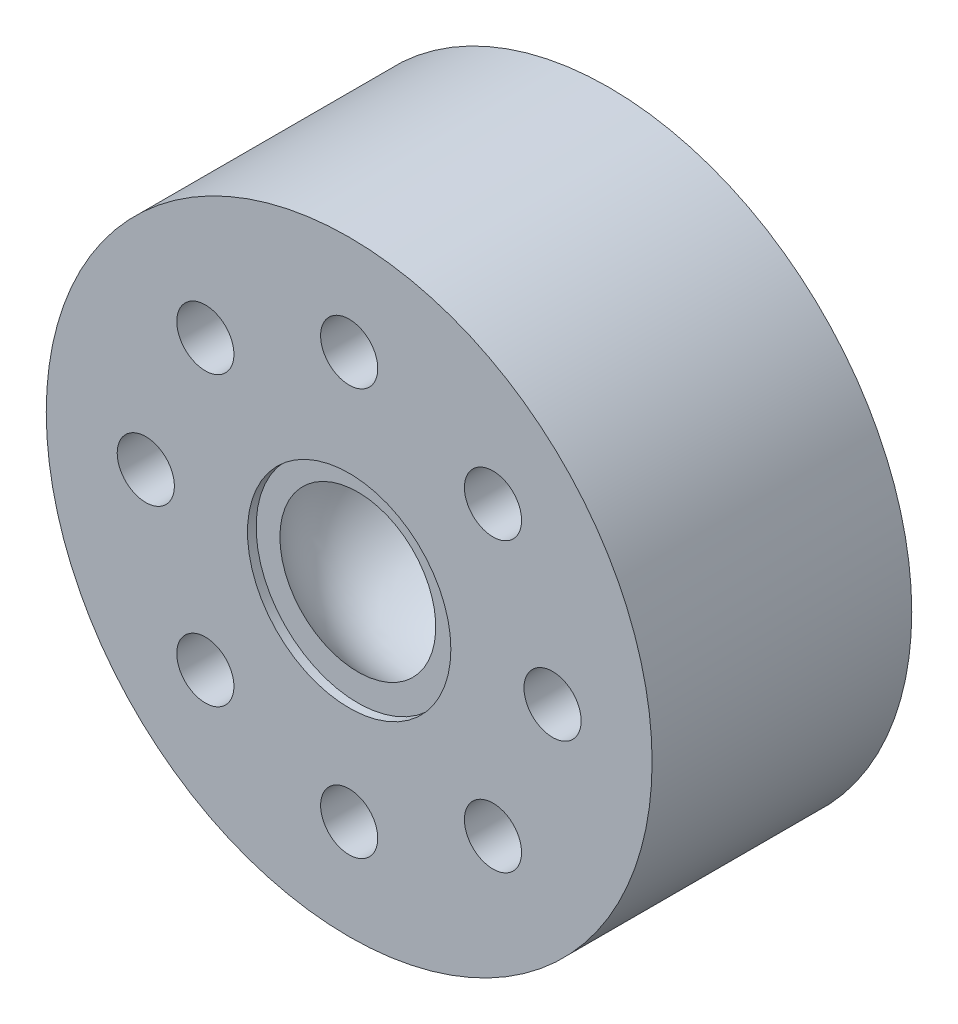
from build123d import *

# Parameters (mm, degrees)
SKETCH1_R           = 35
BOSS_EXTRUDE1_DEPTH = 50
SKETCH2_R           = 11.75
CUT_EXTRUDE1_DEPTH  = 21
SKETCH3_R           = 9
CUT_EXTRUDE2_DEPTH  = 5
SKETCH6_R           = 6.35
CUT_EXTRUDE3_DEPTH  = 71.356236397
CUT_EXTRUDE4_START  = -20
SKETCH7_R           = 35
CUT_EXTRUDE4_DEPTH  = 20
SKETCH9_R           = 3.302
CUT_EXTRUDE6_DEPTH  = 58.879184514


with BuildPart() as part:
    # Sketch1 → Boss-Extrude1 (new body)
    with BuildSketch(Plane.XY):
        Circle(SKETCH1_R)
    extrude(amount=BOSS_EXTRUDE1_DEPTH)

    # Sketch2 → Cut-Extrude1 (cut)
    with BuildSketch(Plane.XY.offset(50)):
        with Locations((0, -0.363798412)):
            Circle(SKETCH2_R)
    extrude(amount=-CUT_EXTRUDE1_DEPTH, mode=Mode.SUBTRACT)

    # Sketch3 → Cut-Extrude2 (cut)
    with BuildSketch(Plane.XY.offset(29)):
        Circle(SKETCH3_R)
    extrude(amount=-CUT_EXTRUDE2_DEPTH, mode=Mode.SUBTRACT)

    # Sketch4 → Cut-Revolve1 (revolve, cut)
    with BuildSketch(Plane(origin=(0, 0, 0), x_dir=(0, 0, -1), z_dir=(1, 0, 0))):
        with BuildLine():
            Line((-8.85349547, 5), (-8.85349547, 0))
            Line((-8.85349547, 0), (-29.014540537, 0))
            Line((-29.014540537, 0), (-29.014540537, 8.986487334))
            add(Edge.make_bspline(
                [(-29.014540537, 8.986487334), (-22.084577695, 17.461249934), (-14.611301832, 9.423177176), (-8.85349547, 5)],
                knots=[0, 0, 0, 0, 1, 1, 1, 1], degree=3))
        make_face()
    revolve(axis=Axis((0, 0, 8.85349547), (0, 0, 1)), mode=Mode.SUBTRACT)

    # Sketch6 → Cut-Extrude3 (cut, through all)
    with BuildSketch(Plane(origin=(0, 0, 0), x_dir=(-1, 0, 0), z_dir=(0, 0, -1))):
        Circle(SKETCH6_R)
    extrude(amount=-CUT_EXTRUDE3_DEPTH, mode=Mode.SUBTRACT)

    # Sketch7 → Cut-Extrude4 (cut)
    with BuildSketch(Plane.XY.offset(50).offset(CUT_EXTRUDE4_START)):
        Circle(SKETCH7_R)
    extrude(amount=CUT_EXTRUDE4_DEPTH, mode=Mode.SUBTRACT)

    # Sketch9 → Cut-Extrude6 (cut, through all)
    with BuildSketch(Plane(origin=(0, 0, 0), x_dir=(-1, 0, 0), z_dir=(0, 0, -1))):
        with Locations((0, -23.5)):
            Circle(SKETCH9_R)
        with Locations((-16.617009358, -16.617009358)):
            Circle(SKETCH9_R)
        with Locations((-23.5, 0)):
            Circle(SKETCH9_R)
        with Locations((-16.617009358, 16.617009358)):
            Circle(SKETCH9_R)
        with Locations((0, 23.5)):
            Circle(SKETCH9_R)
        with Locations((16.617009358, 16.617009358)):
            Circle(SKETCH9_R)
        with Locations((23.5, 0)):
            Circle(SKETCH9_R)
        with Locations((16.617009358, -16.617009358)):
            Circle(SKETCH9_R)
    extrude(amount=-CUT_EXTRUDE6_DEPTH, mode=Mode.SUBTRACT)


solid = part.part
